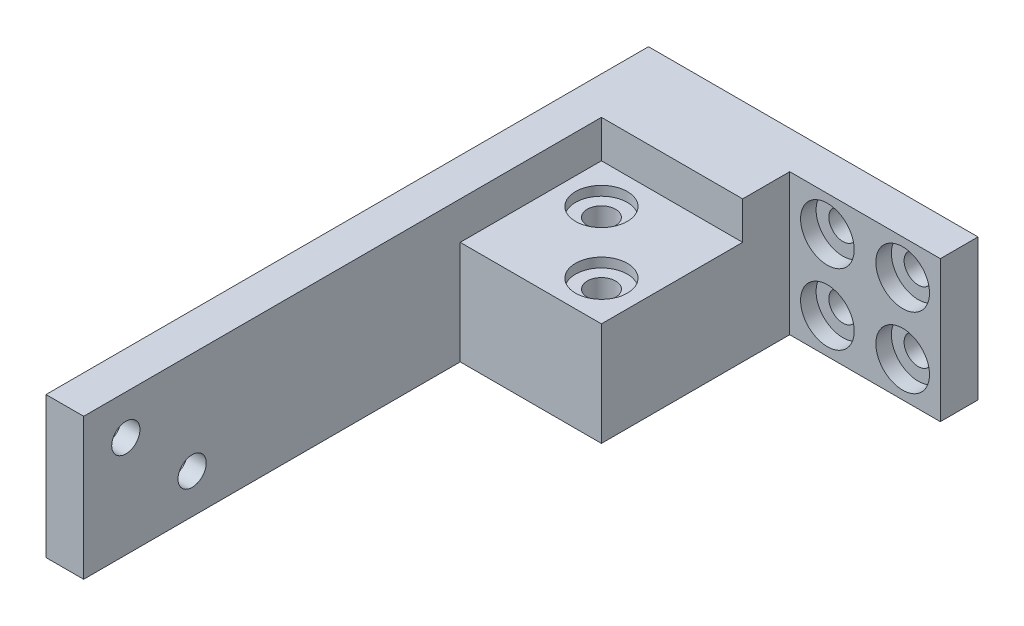
from build123d import *

# Parameters (mm, degrees)
CROQUIS1_W              = 15
CROQUIS1_H              = 15
CROQUIS1_W_2            = 4
CROQUIS1_W_3            = 16
CROQUIS1_R              = 1.5
SALIENTE_EXTRUIR1_DEPTH = 4
CROQUIS2_W              = 4
CROQUIS2_H              = 15
SALIENTE_EXTRUIR2_DEPTH = 60
CROQUIS3_W              = 15
CROQUIS3_H              = 15
SALIENTE_EXTRUIR3_DEPTH = 20
CROQUIS9_R              = 2.85
CORTAR_EXTRUIR3_DEPTH   = 1.65
CORTAR_EXTRUIR4_REACH   = 76.471
CROQUIS4_R              = 1.5
CROQUIS4_3_R            = 1.5
CORTAR_EXTRUIR5_DEPTH   = 2
CROQUIS10_W             = 15
CROQUIS10_H             = 15
CORTAR_EXTRUIR6_DEPTH   = 4
CROQUIS11_R             = 1.5
CORTAR_EXTRUIR7_DEPTH   = 6
CROQUIS11_3_R           = 2.75
CORTAR_EXTRUIR8_DEPTH   = 1


with BuildPart() as part:
    # Croquis1 → Saliente-Extruir1 (new body)
    # profile 1 of 3: a face of its own
    with BuildSketch(Plane.XY):
        with Locations((11.5, 7.5)):
            Rectangle(CROQUIS1_W, CROQUIS1_H)
    # profile 2 of 3: a face of its own
    with BuildSketch(Plane.XY):
        with Locations((2, 7.5)):
            Rectangle(CROQUIS1_W_2, CROQUIS1_H)
    # profile 3 of 3: a face of its own
    with BuildSketch(Plane.XY):
        with Locations((27, 7.5)):
            Rectangle(CROQUIS1_W_3, CROQUIS1_H)
        with Locations((23, 11.25)):
            Circle(CROQUIS1_R, mode=Mode.SUBTRACT)
        with Locations((31, 11.25)):
            Circle(CROQUIS1_R, mode=Mode.SUBTRACT)
        with Locations((31, 3.75)):
            Circle(CROQUIS1_R, mode=Mode.SUBTRACT)
        with Locations((23, 3.75)):
            Circle(CROQUIS1_R, mode=Mode.SUBTRACT)
    extrude(amount=SALIENTE_EXTRUIR1_DEPTH)

    # Croquis2 → Saliente-Extruir2 (add)
    with BuildSketch(Plane.XY.offset(4)):
        with Locations((2, 7.5)):
            Rectangle(CROQUIS2_W, CROQUIS2_H)
    extrude(amount=SALIENTE_EXTRUIR2_DEPTH)

    # Croquis3 → Saliente-Extruir3 (add)
    with BuildSketch(Plane.XY.offset(4)):
        with Locations((11.5, 7.5)):
            Rectangle(CROQUIS3_W, CROQUIS3_H)
    extrude(amount=SALIENTE_EXTRUIR3_DEPTH)

    # Croquis9 → Cortar-Extruir3 (cut)
    with BuildSketch(Plane.XY.offset(4)):
        with Locations((23, 3.75)):
            Circle(CROQUIS9_R)
        with Locations((31, 3.75)):
            Circle(CROQUIS9_R)
        with Locations((23, 11.25)):
            Circle(CROQUIS9_R)
        with Locations((31, 11.25)):
            Circle(CROQUIS9_R)
    extrude(amount=-CORTAR_EXTRUIR3_DEPTH, mode=Mode.SUBTRACT)

    # Croquis4 → Cortar-Extruir4 (cut, up to next)
    with BuildSketch(Plane(origin=(0, 0, 0), x_dir=(0, 0, -1), z_dir=(1, 0, 0)), mode=Mode.PRIVATE) as cortar_extruir4_sk1:
        with Locations(Location((-59.52, 10.8, 0), (0, 0, 180))):
            Circle(CROQUIS4_R)
    cortar_extruir4_tool1 = extrude(cortar_extruir4_sk1.sketch, amount=CORTAR_EXTRUIR4_REACH, mode=Mode.PRIVATE) & part.part
    # Croquis4 → Cortar-Extruir4 (cut, up to next)
    with BuildSketch(Plane(origin=(0, 0, 0), x_dir=(0, 0, -1), z_dir=(1, 0, 0)), mode=Mode.PRIVATE) as cortar_extruir4_sk2:
        with Locations(Location((-52.48, 4.2, 0), (0, 0, 180))):
            Circle(CROQUIS4_R)
    cortar_extruir4_tool2 = extrude(cortar_extruir4_sk2.sketch, amount=CORTAR_EXTRUIR4_REACH, mode=Mode.PRIVATE) & part.part
    add(cortar_extruir4_tool1.solids().sort_by_distance((0, 10.8, 59.52))[0], mode=Mode.SUBTRACT)
    add(cortar_extruir4_tool2.solids().sort_by_distance((0, 4.2, 52.48))[0], mode=Mode.SUBTRACT)

    # Croquis4<3> → Cortar-Extruir5 (cut)
    # profile 1 of 2: a face of its own
    with BuildSketch(Plane(origin=(0, 0, 0), x_dir=(0, 0, -1), z_dir=(1, 0, 0))):
        Polygon((-59.52, 13.975426481), (-62.27, 12.38771324), (-62.27, 9.21228676), (-59.52, 7.624573519), (-56.77, 9.21228676), (-56.77, 12.38771324), align=None)
        with Locations(Location((-59.52, 10.8, 0), (0, 0, 180))):
            Circle(CROQUIS4_3_R, mode=Mode.SUBTRACT)
    # profile 2 of 2: a face of its own
    with BuildSketch(Plane(origin=(0, 0, 0), x_dir=(0, 0, -1), z_dir=(1, 0, 0))):
        Polygon((-52.48, 7.375426481), (-55.23, 5.78771324), (-55.23, 2.61228676), (-52.48, 1.024573519), (-49.73, 2.61228676), (-49.73, 5.78771324), align=None)
        with Locations(Location((-52.48, 4.2, 0), (0, 0, 180))):
            Circle(CROQUIS4_3_R, mode=Mode.SUBTRACT)
    extrude(amount=CORTAR_EXTRUIR5_DEPTH, mode=Mode.SUBTRACT)

    # Croquis10 → Cortar-Extruir6 (cut)
    with BuildSketch(Plane(origin=(0, 15, 0), x_dir=(1, 0, 0), z_dir=(0, 1, 0))):
        with Locations((11.5, -16.5)):
            Rectangle(CROQUIS10_W, CROQUIS10_H)
    extrude(amount=-CORTAR_EXTRUIR6_DEPTH, mode=Mode.SUBTRACT)

    # Croquis11 → Cortar-Extruir7 (cut)
    with BuildSketch(Plane(origin=(0, 11, 0), x_dir=(1, 0, 0), z_dir=(0, 1, 0))):
        with Locations(Location((14.8, -19.8, 0), (0, 0, 270))):
            Circle(CROQUIS11_R)
        with Locations(Location((8.2, -13.2, 0), (0, 0, 270))):
            Circle(CROQUIS11_R)
    extrude(amount=-CORTAR_EXTRUIR7_DEPTH, mode=Mode.SUBTRACT)

    # Croquis11<3> → Cortar-Extruir8 (cut)
    with BuildSketch(Plane(origin=(0, 11, 0), x_dir=(1, 0, 0), z_dir=(0, 1, 0))):
        with Locations(Location((14.8, -19.8, 0), (0, 0, 270))):
            Circle(CROQUIS11_3_R)
        with Locations(Location((8.2, -13.2, 0), (0, 0, 270))):
            Circle(CROQUIS11_3_R)
    extrude(amount=-CORTAR_EXTRUIR8_DEPTH, mode=Mode.SUBTRACT)


solid = part.part
